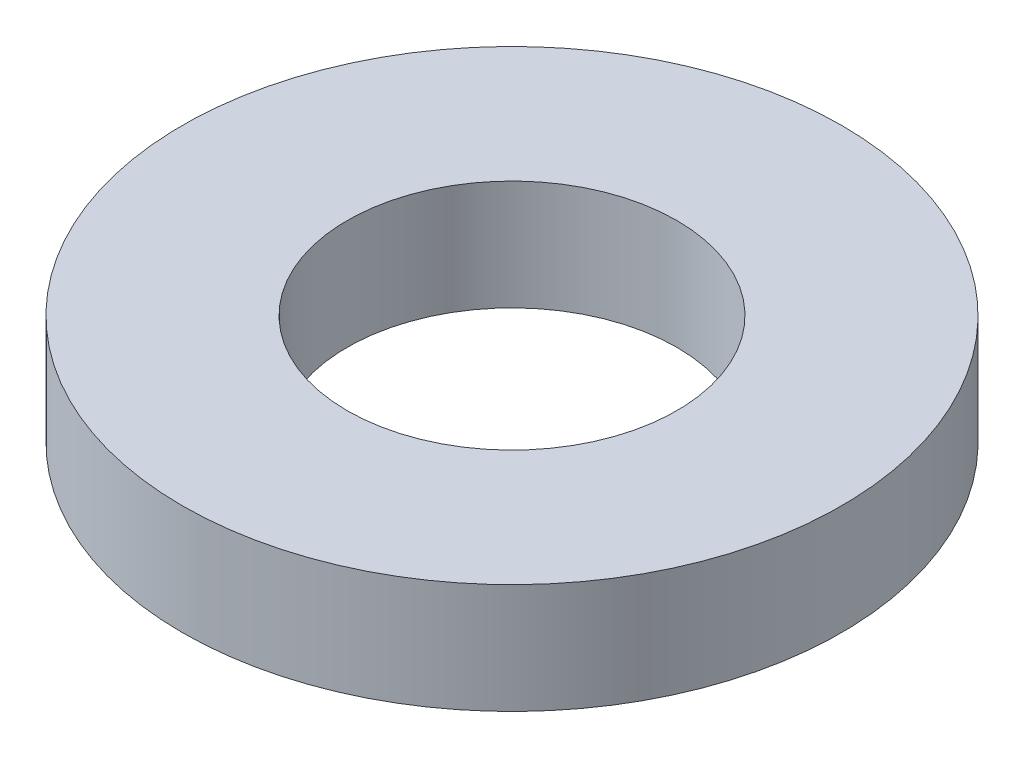
from build123d import *

# Parameters (mm, degrees)
SKETCH_1_R      = 3
SKETCH_1_R_2    = 1.5
EXTRUDE_1_DEPTH = 1


with BuildPart() as part:
    # 草图1 → 凸台-拉伸1 (new body)
    with BuildSketch(Plane(origin=(0, 0, 0), x_dir=(1, 0, 0), z_dir=(0, 1, 0))):
        with Locations(Location((0, 0, 0), (0, 0, 270))):
            Circle(SKETCH_1_R)
        with Locations(Location((0, 0, 0), (0, 0, 270))):
            Circle(SKETCH_1_R_2, mode=Mode.SUBTRACT)
    extrude(amount=EXTRUDE_1_DEPTH)


solid = part.part
